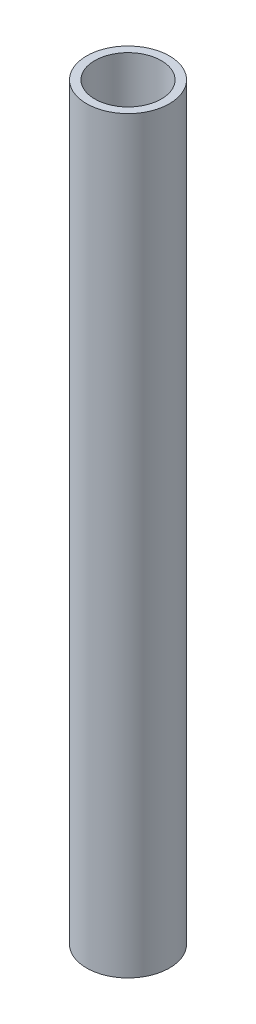
from build123d import *

# Parameters (mm, degrees)
SKETCH2_R           = 12.935
SKETCH2_R_2         = 10.395
BOSS_EXTRUDE1_DEPTH = 233.68


with BuildPart() as part:
    # Sketch2 → Boss-Extrude1 (new body)
    with BuildSketch(Plane(origin=(0, 0, 0), x_dir=(1, 0, 0), z_dir=(0, 1, 0))):
        with Locations(Location((0, 0, 0), (0, 0, 90))):
            Circle(SKETCH2_R)
        with Locations(Location((0, 0, 0), (0, 0, 90))):
            Circle(SKETCH2_R_2, mode=Mode.SUBTRACT)
    extrude(amount=BOSS_EXTRUDE1_DEPTH)


solid = part.part
